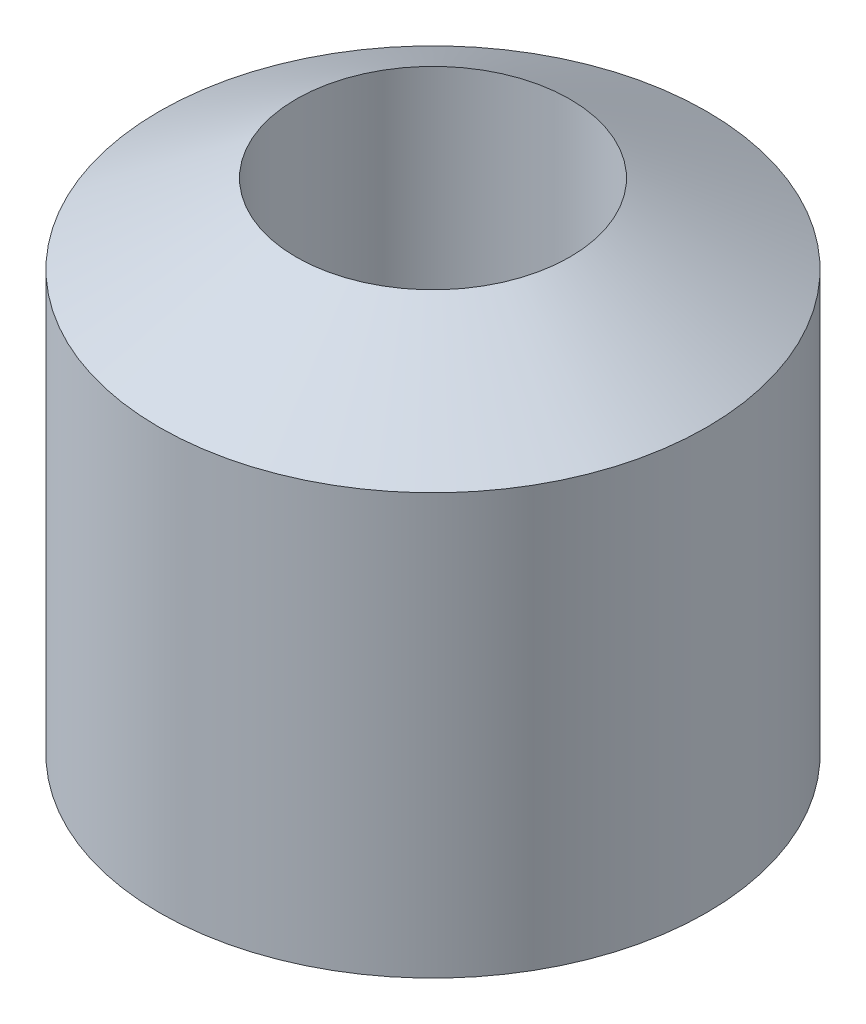
from build123d import *


with BuildPart() as part:
    # Sketch1 → Revolve1 (revolve)
    with BuildSketch(Plane.XY, mode=Mode.PRIVATE) as revolve1_sk:
        Polygon((14, 29.582903769), (28, 21.5), (28, -21.5), (14, -29.582903769), align=None)
    revolve(revolve1_sk.sketch.rotate(Axis((0, 45.914557959, 0), (0, -1, 0)), 90), axis=Axis((0, 45.914557959, 0), (0, -1, 0)))


solid = part.part
